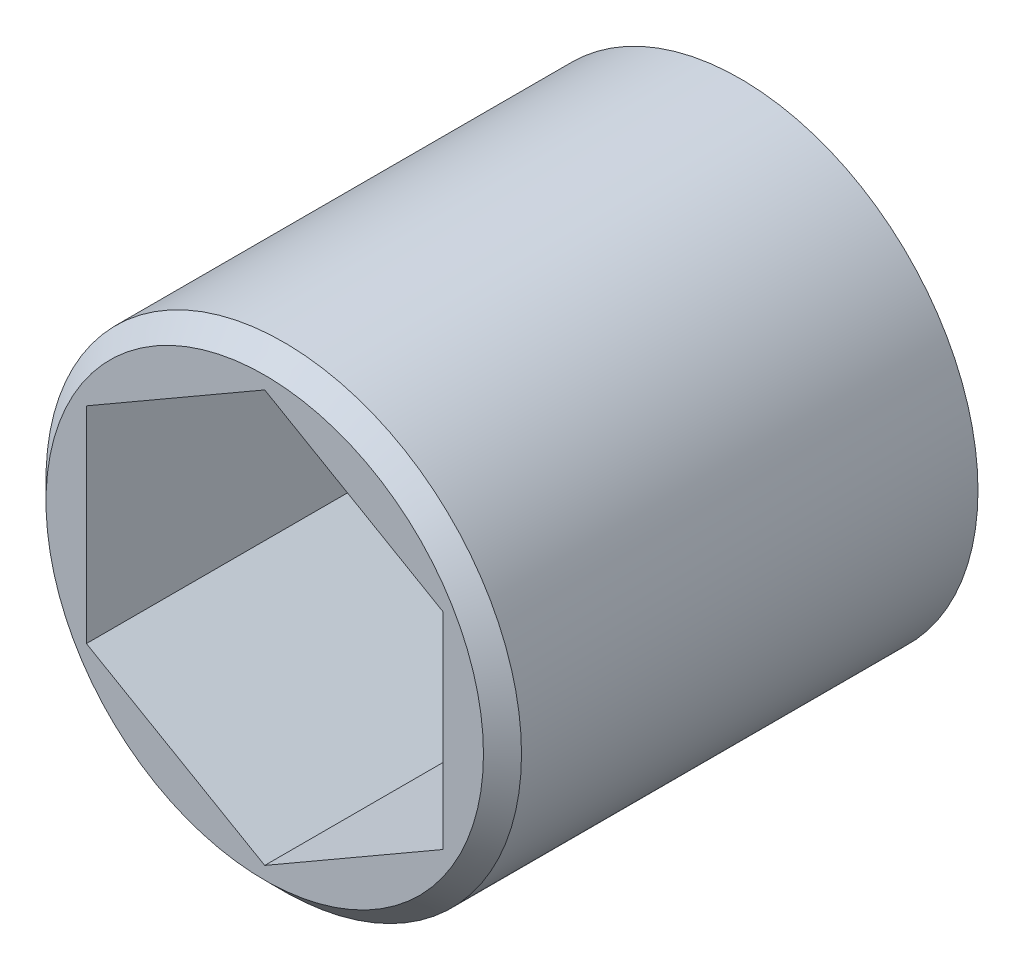
from build123d import *

# Parameters (mm, degrees)
SKETCH1_R           = 6.35
BOSS_EXTRUDE1_DEPTH = 12.7
CUT_EXTRUDE1_DEPTH  = 9.525
SKETCH3_W           = 5.08
SKETCH3_H           = 5.08
CUT_EXTRUDE2_DEPTH  = 9.525
CHAMFER1_SIZE       = 0.508


with BuildPart() as part:
    # Sketch1 → Boss-Extrude1 (new body)
    with BuildSketch(Plane.XY):
        Circle(SKETCH1_R)
    extrude(amount=BOSS_EXTRUDE1_DEPTH)

    # Sketch2 → Cut-Extrude1 (cut)
    with BuildSketch(Plane.XY.offset(12.7)):
        Polygon((0, -5.499261314), (4.7625, -2.749630657), (4.7625, 2.749630657), (0, 5.499261314), (-4.7625, 2.749630657), (-4.7625, -2.749630657), align=None)
    extrude(amount=-CUT_EXTRUDE1_DEPTH, mode=Mode.SUBTRACT)

    # Sketch3 → Cut-Extrude2 (cut)
    with BuildSketch(Plane.XY.offset(3.175)):
        Rectangle(SKETCH3_W, SKETCH3_H)
    extrude(amount=-CUT_EXTRUDE2_DEPTH, mode=Mode.SUBTRACT)

    # Chamfer1
    chamfer1_edges = [part.edges().sort_by_distance(p)[0] for p in [
        (-6.35, 0, 12.7),
    ]]
    chamfer(chamfer1_edges, length=CHAMFER1_SIZE)


solid = part.part
